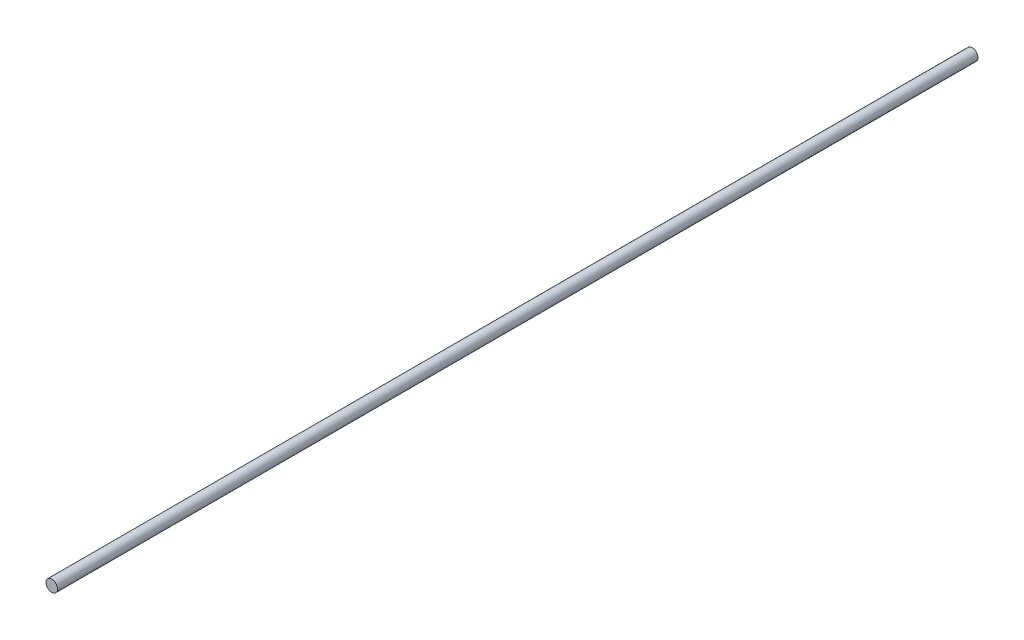
from build123d import *

# Parameters (mm, degrees)
SKETCH1_R           = 2.5
BOSS_EXTRUDE1_DEPTH = 400


with BuildPart() as part:
    # Sketch1 → Boss-Extrude1 (new body)
    with BuildSketch(Plane.XY):
        Circle(SKETCH1_R)
    extrude(amount=BOSS_EXTRUDE1_DEPTH)


solid = part.part
